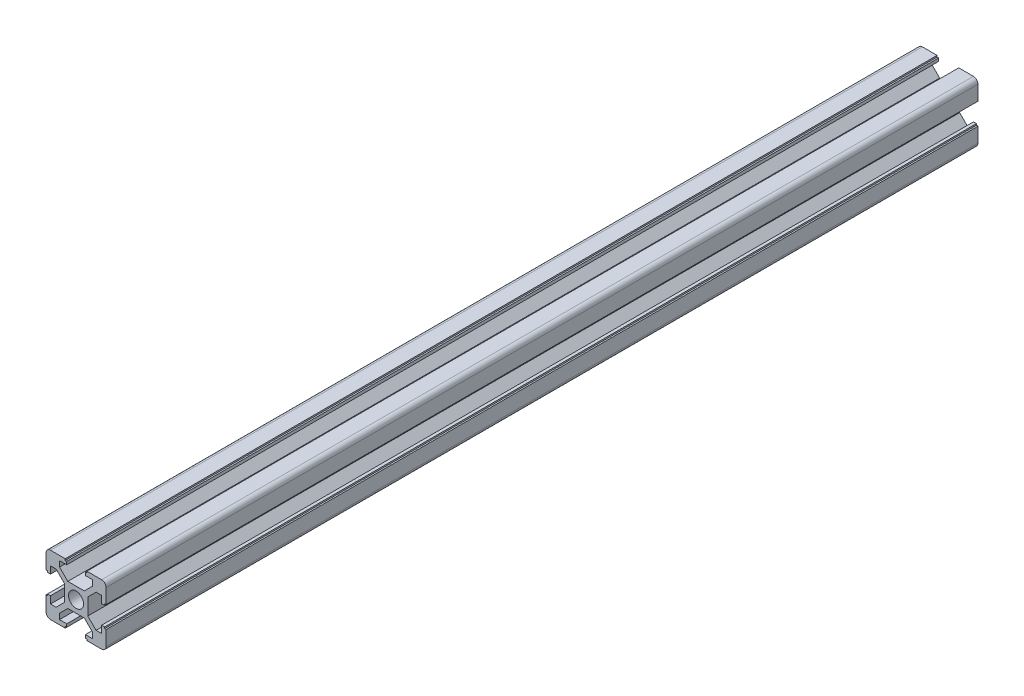
from build123d import *

# Parameters (mm, degrees)
SKETCH1_R       = 2.5
EXTRUDE_1_DEPTH = 290


with BuildPart() as part:
    # Sketch1 → 凸台-拉伸1 (new body)
    with BuildSketch(Plane.XY):
        with BuildLine():
            Line((-3.6, 10), (-3.6, 9.5))
            Line((-3.6, 9.5), (-3.1, 9.5))
            Line((-3.1, 9.5), (-3.1, 8.5))
            Line((-3.1, 8.5), (-5.5, 8.5))
            Line((-5.5, 8.5), (-5.5, 6.65))
            Line((-5.5, 6.65), (-2.75, 3.9))
            Line((-2.75, 3.9), (2.75, 3.9))
            Line((2.75, 3.9), (5.5, 6.65))
            Line((5.5, 6.65), (5.5, 8.5))
            Line((5.5, 8.5), (3.1, 8.5))
            Line((3.1, 8.5), (3.1, 9.5))
            Line((3.1, 9.5), (3.6, 9.5))
            Line((3.6, 9.5), (3.6, 10))
            Line((3.6, 10), (8.5, 10))
            ThreePointArc((8.5, 10), (9.560660172, 9.560660172), (10, 8.5))
            Line((10, 8.5), (10, 3.6))
            Line((10, 3.6), (9.5, 3.6))
            Line((9.5, 3.6), (9.5, 3.1))
            Line((9.5, 3.1), (8.5, 3.1))
            Line((8.5, 3.1), (8.5, 5.5))
            Line((8.5, 5.5), (6.65, 5.5))
            Line((6.65, 5.5), (3.9, 2.75))
            Line((3.9, 2.75), (3.9, -2.75))
            Line((3.9, -2.75), (6.65, -5.5))
            Line((6.65, -5.5), (8.5, -5.5))
            Line((8.5, -5.5), (8.5, -3.1))
            Line((8.5, -3.1), (9.5, -3.1))
            Line((9.5, -3.1), (9.5, -3.6))
            Line((9.5, -3.6), (10, -3.6))
            Line((10, -3.6), (10, -8.5))
            ThreePointArc((10, -8.5), (9.560660172, -9.560660172), (8.5, -10))
            Line((8.5, -10), (3.6, -10))
            Line((3.6, -10), (3.6, -9.5))
            Line((3.6, -9.5), (3.1, -9.5))
            Line((3.1, -9.5), (3.1, -8.5))
            Line((3.1, -8.5), (5.5, -8.5))
            Line((5.5, -8.5), (5.5, -6.65))
            Line((5.5, -6.65), (2.75, -3.9))
            Line((2.75, -3.9), (-2.75, -3.9))
            Line((-2.75, -3.9), (-5.5, -6.65))
            Line((-5.5, -6.65), (-5.5, -8.5))
            Line((-5.5, -8.5), (-3.1, -8.5))
            Line((-3.1, -8.5), (-3.1, -9.5))
            Line((-3.1, -9.5), (-3.6, -9.5))
            Line((-3.6, -9.5), (-3.6, -10))
            Line((-3.6, -10), (-8.5, -10))
            ThreePointArc((-8.5, -10), (-9.560660172, -9.560660172), (-10, -8.5))
            Line((-10, -8.5), (-10, -3.6))
            Line((-10, -3.6), (-9.5, -3.6))
            Line((-9.5, -3.6), (-9.5, -3.1))
            Line((-9.5, -3.1), (-8.5, -3.1))
            Line((-8.5, -3.1), (-8.5, -5.5))
            Line((-8.5, -5.5), (-6.65, -5.5))
            Line((-6.65, -5.5), (-3.9, -2.75))
            Line((-3.9, -2.75), (-3.9, 2.75))
            Line((-3.9, 2.75), (-6.65, 5.5))
            Line((-6.65, 5.5), (-8.5, 5.5))
            Line((-8.5, 5.5), (-8.5, 3.1))
            Line((-8.5, 3.1), (-9.5, 3.1))
            Line((-9.5, 3.1), (-9.5, 3.6))
            Line((-9.5, 3.6), (-10, 3.6))
            Line((-10, 3.6), (-10, 8.5))
            ThreePointArc((-10, 8.5), (-9.560660172, 9.560660172), (-8.5, 10))
            Line((-8.5, 10), (-3.6, 10))
        make_face()
        Circle(SKETCH1_R, mode=Mode.SUBTRACT)
    extrude(amount=EXTRUDE_1_DEPTH)


solid = part.part
